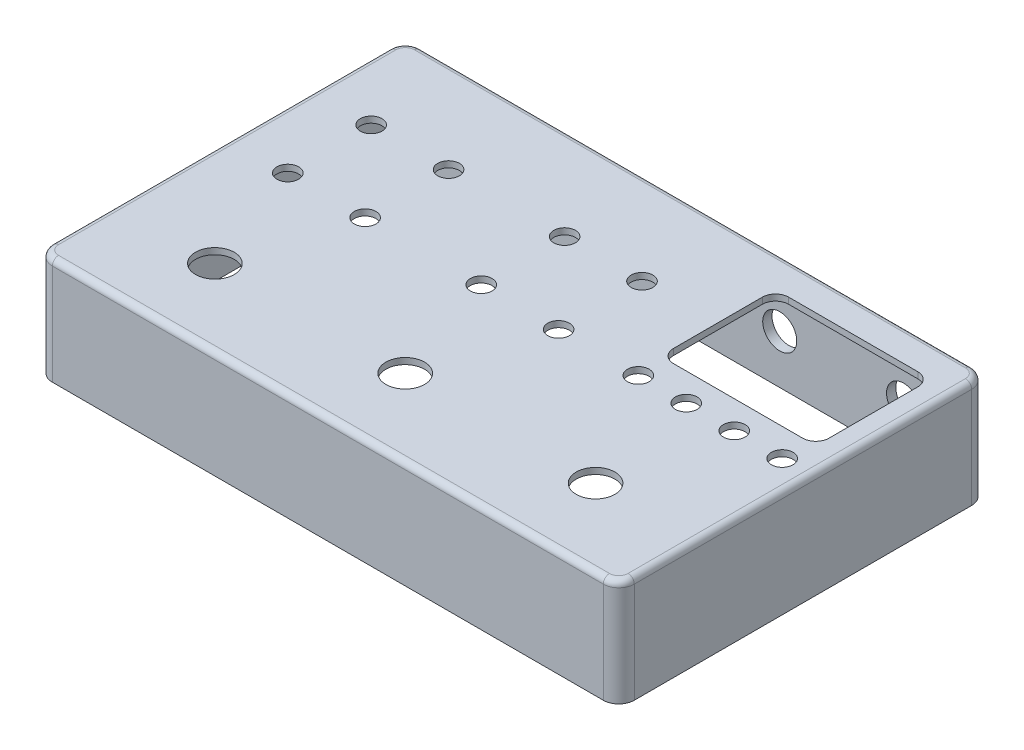
from build123d import *
from build123d.topology import SkipClean

# Parameters (mm, degrees)
SKETCH_1_W          = 188
SKETCH_1_H          = 119
SKETCH_1_R          = 3.5
SKETCH_1_R_2        = 6.25
EXTRUDE_1_DEPTH     = 34.5
SKETCH_3_W          = 182
SKETCH_3_H          = 113
CUT_EXTRUDE_2_DEPTH = 31.5
CUT_EXTRUDE_START   = -3
CUT_EXTRUDE_1_DEPTH = 3
FILLET_1_R          = 5
EXTRUDE_2_DEPTH     = 31.5
SKETCH_6_R          = 2.25
CUT_EXTRUDE_3_DEPTH = 20
FILLET_2_R          = 2
SKETCH_7_W          = 10
SKETCH_7_H          = 7
SKETCH_7_R          = 1.75
CUT_EXTRUDE_4_DEPTH = 20
CUT_EXTRUDE_START_2 = -1
CUT_EXTRUDE_5_DEPTH = 1


with BuildPart() as part:
    # 草图1 → 凸台-拉伸1 (new body)
    with BuildSketch(Plane(origin=(0, 0, 0), x_dir=(1, 0, 0), z_dir=(0, 1, 0))):
        with Locations((7.810018722, -2.552710251)):
            Rectangle(SKETCH_1_W, SKETCH_1_H)
        with Locations(Location((-67.189981278, 26.947289749, 0), (0, 0, 270))):
            Circle(SKETCH_1_R, mode=Mode.SUBTRACT)
        with Locations(Location((-42.189981278, 26.947289749, 0), (0, 0, 270))):
            Circle(SKETCH_1_R, mode=Mode.SUBTRACT)
        with Locations(Location((-67.189981278, 0, 0), (0, 0, 270))):
            Circle(SKETCH_1_R, mode=Mode.SUBTRACT)
        with Locations(Location((-42.189981278, 0, 0), (0, 0, 270))):
            Circle(SKETCH_1_R, mode=Mode.SUBTRACT)
        with Locations(Location((-4.689981278, 26.947289749, 0), (0, 0, 270))):
            Circle(SKETCH_1_R, mode=Mode.SUBTRACT)
        with Locations(Location((20.310018722, 26.947289749, 0), (0, 0, 270))):
            Circle(SKETCH_1_R, mode=Mode.SUBTRACT)
        with Locations(Location((-4.689981278, 0, 0), (0, 0, 270))):
            Circle(SKETCH_1_R, mode=Mode.SUBTRACT)
        with Locations(Location((20.310018722, 0, 0), (0, 0, 270))):
            Circle(SKETCH_1_R, mode=Mode.SUBTRACT)
        with Locations(Location((46.060018722, 0, 0), (0, 0, 270))):
            Circle(SKETCH_1_R, mode=Mode.SUBTRACT)
        with Locations(Location((61.560018722, 0, 0), (0, 0, 270))):
            Circle(SKETCH_1_R, mode=Mode.SUBTRACT)
        with Locations(Location((77.060018722, 0, 0), (0, 0, 270))):
            Circle(SKETCH_1_R, mode=Mode.SUBTRACT)
        with Locations(Location((92.560018722, 0, 0), (0, 0, 270))):
            Circle(SKETCH_1_R, mode=Mode.SUBTRACT)
        with Locations(Location((-53.689981278, -37.052710251, 0), (0, 0, 270))):
            Circle(SKETCH_1_R_2, mode=Mode.SUBTRACT)
        with Locations(Location((7.810018722, -37.052710251, 0), (0, 0, 270))):
            Circle(SKETCH_1_R_2, mode=Mode.SUBTRACT)
        with Locations(Location((69.310018722, -37.052710251, 0), (0, 0, 270))):
            Circle(SKETCH_1_R_2, mode=Mode.SUBTRACT)
        with BuildLine():
            Line((48.445018722, 45.947289749), (90.175018722, 45.947289749))
            ThreePointArc((90.175018722, 45.947289749), (93.003445847, 44.775716874), (94.175018722, 41.947289749))
            Line((94.175018722, 41.947289749), (94.175018722, 13.247289749))
            ThreePointArc((94.175018722, 13.247289749), (93.003445847, 10.418862624), (90.175018722, 9.247289749))
            Line((90.175018722, 9.247289749), (48.445018722, 9.247289749))
            ThreePointArc((48.445018722, 9.247289749), (45.616591597, 10.418862624), (44.445018722, 13.247289749))
            Line((44.445018722, 13.247289749), (44.445018722, 41.947289749))
            ThreePointArc((44.445018722, 41.947289749), (45.616591597, 44.775716874), (48.445018722, 45.947289749))
        make_face(mode=Mode.SUBTRACT)
    extrude(amount=EXTRUDE_1_DEPTH)

    # 草图3 → 切除-拉伸2 (cut)
    with BuildSketch(Plane.XZ):
        with Locations((7.810018722, 2.552710251)):
            Rectangle(SKETCH_3_W, SKETCH_3_H)
    extrude(amount=-CUT_EXTRUDE_2_DEPTH, mode=Mode.SUBTRACT)

    # 草图4 → 切除-拉伸-薄壁1 (cut)
    with BuildSketch(Plane(origin=(0, 34.5, 0), x_dir=(1, 0, 0), z_dir=(0, 1, 0)).offset(CUT_EXTRUDE_START)):
        with BuildLine():
            Line((94.425018722, 13.247289749), (94.425018722, 41.947289749))
            ThreePointArc((94.425018722, 41.947289749), (93.180222542, 44.952493569), (90.175018722, 46.197289749))
            Line((90.175018722, 46.197289749), (48.445018722, 46.197289749))
            ThreePointArc((48.445018722, 46.197289749), (45.439814902, 44.952493569), (44.195018722, 41.947289749))
            Line((44.195018722, 41.947289749), (44.195018722, 13.247289749))
            ThreePointArc((44.195018722, 13.247289749), (45.439814902, 10.242085929), (48.445018722, 8.997289749))
            Line((48.445018722, 8.997289749), (90.175018722, 8.997289749))
            ThreePointArc((90.175018722, 8.997289749), (93.180222542, 10.242085929), (94.425018722, 13.247289749))
        make_face()
        with BuildLine():
            Line((94.175018722, 13.247289749), (94.175018722, 41.947289749))
            ThreePointArc((94.175018722, 41.947289749), (93.003445847, 44.775716874), (90.175018722, 45.947289749))
            Line((90.175018722, 45.947289749), (48.445018722, 45.947289749))
            ThreePointArc((48.445018722, 45.947289749), (45.616591597, 44.775716874), (44.445018722, 41.947289749))
            Line((44.445018722, 41.947289749), (44.445018722, 13.247289749))
            ThreePointArc((44.445018722, 13.247289749), (45.616591597, 10.418862624), (48.445018722, 9.247289749))
            Line((48.445018722, 9.247289749), (90.175018722, 9.247289749))
            ThreePointArc((90.175018722, 9.247289749), (93.003445847, 10.418862624), (94.175018722, 13.247289749))
        make_face(mode=Mode.SUBTRACT)
    extrude(amount=CUT_EXTRUDE_1_DEPTH, mode=Mode.SUBTRACT)

    # 圆角1
    fillet_1_edges = [part.edges().sort_by_distance(p)[0] for p in [
        (98.810018722, 15.75, -53.947289749),
        (98.810018722, 15.75, 59.052710251),
        (-83.189981278, 15.75, 59.052710251),
        (-83.189981278, 15.75, -53.947289749),
        (-86.189981278, 17.25, -56.947289749),
        (101.810018722, 17.25, -56.947289749),
        (101.810018722, 17.25, 62.052710251),
        (-86.189981278, 17.25, 62.052710251),
    ]]
    fillet(fillet_1_edges, radius=FILLET_1_R)

    # 草图5 → 凸台-拉伸2 (add)
    with BuildSketch(Plane.XZ.offset(-31.5)):
        with BuildLine():
            ThreePointArc((-83.18972874, 54.102962789), (-82.045688452, 53.325938171), (-80.689981278, 53.052710251))
            Line((-80.689981278, 53.052710251), (-80.689981278, 56.552710251))
            Line((-80.689981278, 56.552710251), (-77.189981278, 56.552710251))
            ThreePointArc((-77.189981278, 56.552710251), (-77.463209198, 57.908417425), (-78.240233816, 59.052457713))
            ThreePointArc((-78.240233816, 59.052457713), (-81.725515184, 57.588244157), (-83.18972874, 54.102962789))
        make_face()
        with BuildLine():
            Line((-80.689981278, 56.552710251), (-80.689981278, 53.052710251))
            ThreePointArc((-80.689981278, 53.052710251), (-78.215107544, 54.077836517), (-77.189981278, 56.552710251))
            Line((-77.189981278, 56.552710251), (-80.689981278, 56.552710251))
        make_face()
        with BuildLine():
            Line((-77.189981278, -51.447289749), (-80.689981278, -51.447289749))
            Line((-80.689981278, -51.447289749), (-80.689981278, -47.947289749))
            ThreePointArc((-80.689981278, -47.947289749), (-82.045688452, -48.220517669), (-83.18972874, -48.997542287))
            ThreePointArc((-83.18972874, -48.997542287), (-81.725515184, -52.482823655), (-78.240233816, -53.947037211))
            ThreePointArc((-78.240233816, -53.947037211), (-77.463209198, -52.802996923), (-77.189981278, -51.447289749))
        make_face()
        with BuildLine():
            Line((-80.689981278, -47.947289749), (-80.689981278, -51.447289749))
            Line((-80.689981278, -51.447289749), (-77.189981278, -51.447289749))
            ThreePointArc((-77.189981278, -51.447289749), (-78.215107544, -48.972416015), (-80.689981278, -47.947289749))
        make_face()
        with BuildLine():
            ThreePointArc((92.810018722, 56.552710251), (93.835144988, 54.077836517), (96.310018722, 53.052710251))
            Line((96.310018722, 53.052710251), (96.310018722, 56.552710251))
            Line((96.310018722, 56.552710251), (92.810018722, 56.552710251))
        make_face()
        with BuildLine():
            Line((96.310018722, 56.552710251), (96.310018722, 53.052710251))
            ThreePointArc((96.310018722, 53.052710251), (97.665725896, 53.325938171), (98.809766184, 54.102962789))
            ThreePointArc((98.809766184, 54.102962789), (97.345552628, 57.588244157), (93.86027126, 59.052457713))
            ThreePointArc((93.86027126, 59.052457713), (93.083246642, 57.908417425), (92.810018722, 56.552710251))
            Line((92.810018722, 56.552710251), (96.310018722, 56.552710251))
        make_face()
        with BuildLine():
            ThreePointArc((96.310018722, -47.947289749), (93.835144988, -48.972416015), (92.810018722, -51.447289749))
            Line((92.810018722, -51.447289749), (96.310018722, -51.447289749))
            Line((96.310018722, -51.447289749), (96.310018722, -47.947289749))
        make_face()
        with BuildLine():
            Line((96.310018722, -51.447289749), (92.810018722, -51.447289749))
            ThreePointArc((92.810018722, -51.447289749), (93.083246642, -52.802996923), (93.86027126, -53.947037211))
            ThreePointArc((93.86027126, -53.947037211), (97.345552628, -52.482823655), (98.809766184, -48.997542287))
            ThreePointArc((98.809766184, -48.997542287), (97.665725896, -48.220517669), (96.310018722, -47.947289749))
            Line((96.310018722, -47.947289749), (96.310018722, -51.447289749))
        make_face()
    extrude(amount=EXTRUDE_2_DEPTH)

    # 草图6 → 切除-拉伸3 (cut)
    with BuildSketch(Plane.XZ):
        with Locations(Location((96.310018722, -51.447289749, 0), (0, 0, 270))):
            Circle(SKETCH_6_R)
        with Locations(Location((96.310018722, 56.552710251, 0), (0, 0, 270))):
            Circle(SKETCH_6_R)
        with Locations(Location((-80.689981278, 56.552710251, 0), (0, 0, 270))):
            Circle(SKETCH_6_R)
        with Locations(Location((-80.689981278, -51.447289749, 0), (0, 0, 270))):
            Circle(SKETCH_6_R)
    extrude(amount=-CUT_EXTRUDE_3_DEPTH, mode=Mode.SUBTRACT)

    # 圆角2
    fillet_2_edges = [part.edges().sort_by_distance(p)[0] for p in [
        (-86.189981278, 34.5, 2.552710251),
        (7.810018722, 34.5, -56.947289749),
        (7.810018722, 34.5, 62.052710251),
        (101.810018722, 34.5, 2.552710251),
        (100.345552628, 34.5, 60.588244157),
        (100.345552628, 34.5, -55.482823655),
        (-84.725515184, 34.5, 60.588244157),
        (-84.725515184, 34.5, -55.482823655),
    ]]
    fillet(fillet_2_edges, radius=FILLET_2_R)

    # 草图7 → 切除-拉伸4 (cut)
    with BuildSketch(Plane(origin=(0, 0, -56.947289749), x_dir=(-1, 0, 0), z_dir=(0, 0, -1))):
        with BuildLine():
            ThreePointArc((67.689981278, 15.75), (62.189981278, 21.25), (56.689981278, 15.75))
            Line((56.689981278, 15.75), (67.689981278, 15.75))
        make_face()
        with BuildLine():
            Line((67.689981278, 15.75), (56.689981278, 15.75))
            ThreePointArc((56.689981278, 15.75), (62.189981278, 10.25), (67.689981278, 15.75))
        make_face()
        with BuildLine():
            ThreePointArc((-72.310018722, 15.75), (-77.810018722, 21.25), (-83.310018722, 15.75))
            Line((-83.310018722, 15.75), (-72.310018722, 15.75))
        make_face()
        with BuildLine():
            Line((-72.310018722, 15.75), (-83.310018722, 15.75))
            ThreePointArc((-83.310018722, 15.75), (-77.810018722, 10.25), (-72.310018722, 15.75))
        make_face()
        with BuildLine():
            ThreePointArc((-32.310018722, 15.75), (-37.810018722, 21.25), (-43.310018722, 15.75))
            Line((-43.310018722, 15.75), (-32.310018722, 15.75))
        make_face()
        with BuildLine():
            Line((-32.310018722, 15.75), (-43.310018722, 15.75))
            ThreePointArc((-43.310018722, 15.75), (-37.810018722, 10.25), (-32.310018722, 15.75))
        make_face()
        with BuildLine():
            ThreePointArc((15.189981278, 15.75), (12.189981278, 18.75), (9.189981278, 15.75))
            Line((9.189981278, 15.75), (15.189981278, 15.75))
        make_face()
        with BuildLine():
            Line((15.189981278, 15.75), (9.189981278, 15.75))
            ThreePointArc((9.189981278, 15.75), (12.189981278, 12.75), (15.189981278, 15.75))
        make_face()
        with Locations((32.189981278, 15.75)):
            Rectangle(SKETCH_7_W, SKETCH_7_H)
        with Locations((23.689981278, 15.75)):
            Circle(SKETCH_7_R)
        with Locations((40.689981278, 15.75)):
            Circle(SKETCH_7_R)
    extrude(amount=-CUT_EXTRUDE_4_DEPTH, mode=Mode.SUBTRACT)

    # 草图10 → 切除-拉伸5 (cut)
    with SkipClean():  # the faces are left unmerged after this step: merging them gives an invalid solid
        with BuildSketch(Plane.XZ.offset(-31.5).offset(CUT_EXTRUDE_START_2)):
            with BuildLine():
                Line((98.810018722, -48.947289749), (98.810018722, 54.052710251))
                ThreePointArc((98.810018722, 54.052710251), (98.809955587, 54.077836837), (98.809766184, 54.102962789))
                ThreePointArc((98.809766184, 54.102962789), (93.835144988, 54.077836517), (93.86027126, 59.052457713))
                ThreePointArc((93.86027126, 59.052457713), (93.835145308, 59.052647116), (93.810018722, 59.052710251))
                Line((93.810018722, 59.052710251), (-78.189981278, 59.052710251))
                ThreePointArc((-78.189981278, 59.052710251), (-78.215107864, 59.052647116), (-78.240233816, 59.052457713))
                ThreePointArc((-78.240233816, 59.052457713), (-78.215107544, 54.077836517), (-83.18972874, 54.102962789))
                ThreePointArc((-83.18972874, 54.102962789), (-83.189918143, 54.077836837), (-83.189981278, 54.052710251))
                Line((-83.189981278, 54.052710251), (-83.189981278, -48.947289749))
                ThreePointArc((-83.189981278, -48.947289749), (-83.189918143, -48.972416335), (-83.18972874, -48.997542287))
                ThreePointArc((-83.18972874, -48.997542287), (-78.215107544, -48.972416015), (-78.240233816, -53.947037211))
                ThreePointArc((-78.240233816, -53.947037211), (-78.215107864, -53.947226614), (-78.189981278, -53.947289749))
                Line((-78.189981278, -53.947289749), (93.810018722, -53.947289749))
                ThreePointArc((93.810018722, -53.947289749), (93.835145308, -53.947226614), (93.86027126, -53.947037211))
                ThreePointArc((93.86027126, -53.947037211), (93.835144988, -48.972416015), (98.809766184, -48.997542287))
                ThreePointArc((98.809766184, -48.997542287), (98.809955587, -48.972416335), (98.810018722, -48.947289749))
            make_face()
        extrude(amount=CUT_EXTRUDE_5_DEPTH, mode=Mode.SUBTRACT)


solid = part.part
